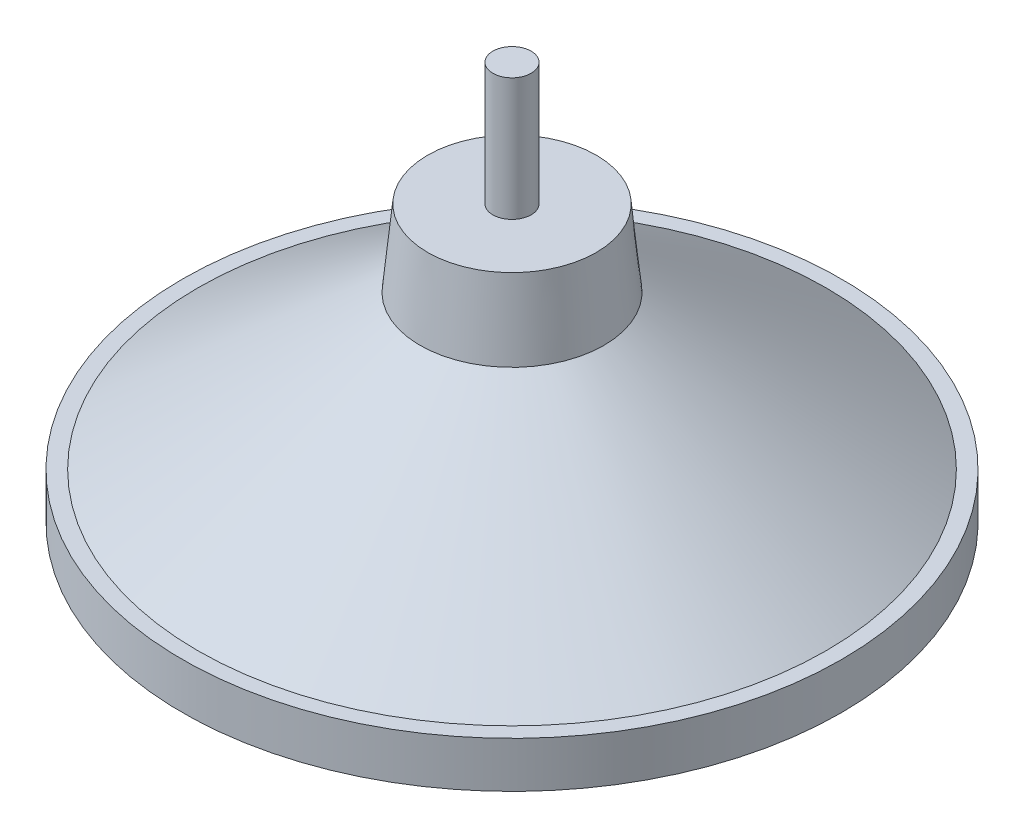
from build123d import *


with BuildPart() as part:
    # Sketch1 → Revolve1 (revolve)
    with BuildSketch(Plane.XY, mode=Mode.PRIVATE) as revolve1_sk:
        Polygon((0, 0), (68.2625, 0), (68.2625, 9.525), (65.0875, 9.525), (19.05, 41.275), (17.4625, 57.15), (3.96875, 57.15), (3.96875, 82.55), (0, 82.55), (0, 57.15), align=None)
    revolve(revolve1_sk.sketch.rotate(Axis((0, 57.15, 0), (0, -1, 0)), 180), axis=Axis((0, 57.15, 0), (0, -1, 0)))


solid = part.part
